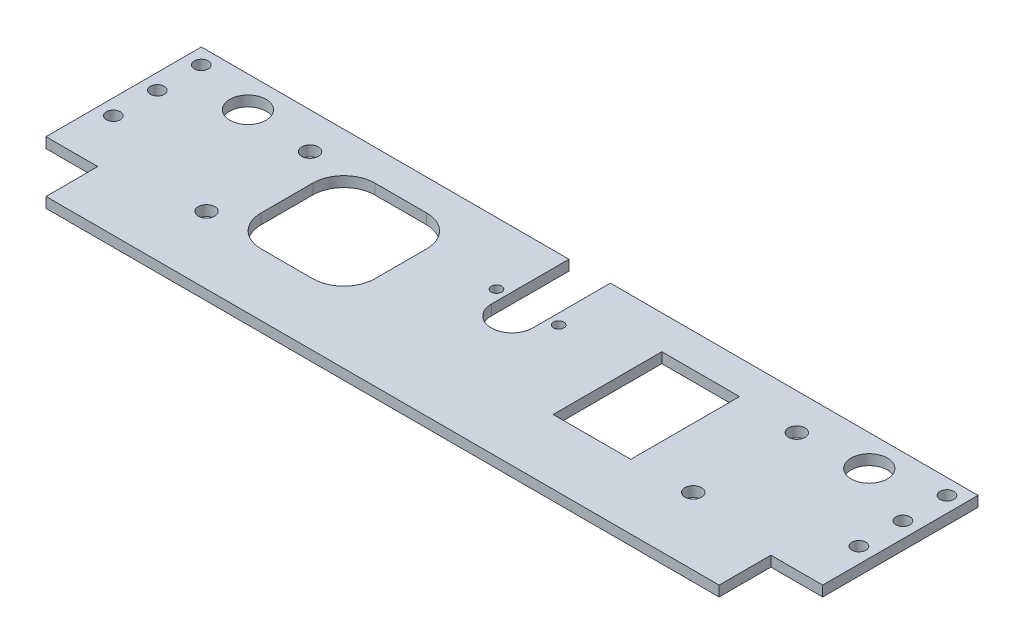
from build123d import *

# Parameters (mm, degrees)
SKETCH_1_R          = 1.35
SKETCH_1_R_2        = 3.5
SKETCH_1_R_3        = 1.6
SKETCH_1_R_4        = 1
SKETCH_1_W          = 22
SKETCH_1_H          = 22
SKETCH_1_W_2        = 15
SKETCH_1_H_2        = 21
EXTRUDE_1_DEPTH     = 2
FILLET_1_R          = 6
SKETCH_2_W          = 16.043978469
SKETCH_2_H          = 25.917195988
CUT_EXTRUDE_1_DEPTH = 79.472925267


with BuildPart() as part:
    # 草图1 → 凸台-拉伸1 (new body)
    with BuildSketch(Plane(origin=(0, 0, 0), x_dir=(1, 0, 0), z_dir=(0, 1, 0))):
        with BuildLine():
            Line((-75, 17), (-4, 17))
            Line((-4, 17), (-4, 2))
            ThreePointArc((-4, 2), (0, -2), (4, 2))
            Line((4, 2), (4, 17))
            Line((4, 17), (75, 17))
            Line((75, 17), (75, -17))
            Line((75, -17), (75, -23))
            Line((75, -23), (-75, -23))
            Line((-75, -23), (-75, -17))
            Line((-75, -17), (-75, 17))
        make_face()
        with Locations(Location((-72, 14, 0), (0, 0, 270))):
            Circle(SKETCH_1_R, mode=Mode.SUBTRACT)
        with Locations(Location((-72, -3, 0), (0, 0, 270))):
            Circle(SKETCH_1_R, mode=Mode.SUBTRACT)
        with Locations(Location((72, -3, 0), (0, 0, 90))):
            Circle(SKETCH_1_R, mode=Mode.SUBTRACT)
        with Locations(Location((72, 14, 0), (0, 0, 90))):
            Circle(SKETCH_1_R, mode=Mode.SUBTRACT)
        with Locations(Location((-60, 11, 0), (0, 0, 270))):
            Circle(SKETCH_1_R_2, mode=Mode.SUBTRACT)
        with Locations(Location((60, 11, 0), (0, 0, 90))):
            Circle(SKETCH_1_R_2, mode=Mode.SUBTRACT)
        with Locations(Location((-47, 10, 0), (0, 0, 270))):
            Circle(SKETCH_1_R_3, mode=Mode.SUBTRACT)
        with Locations(Location((47, 10, 0), (0, 0, 90))):
            Circle(SKETCH_1_R_3, mode=Mode.SUBTRACT)
        with Locations(Location((47, -10, 0), (0, 0, 270))):
            Circle(SKETCH_1_R_3, mode=Mode.SUBTRACT)
        with Locations(Location((-47, -10, 0), (0, 0, 90))):
            Circle(SKETCH_1_R_3, mode=Mode.SUBTRACT)
        with Locations(Location((-6, 5, 0), (0, 0, 270))):
            Circle(SKETCH_1_R_4, mode=Mode.SUBTRACT)
        with Locations(Location((6, 5, 0), (0, 0, 90))):
            Circle(SKETCH_1_R_4, mode=Mode.SUBTRACT)
        with Locations(Location((-72, 5.5, 0), (0, 0, 270))):
            Circle(SKETCH_1_R, mode=Mode.SUBTRACT)
        with Locations(Location((72, 5.5, 0), (0, 0, 90))):
            Circle(SKETCH_1_R, mode=Mode.SUBTRACT)
        with Locations((-30.48, 0)):
            Rectangle(SKETCH_1_W, SKETCH_1_H, mode=Mode.SUBTRACT)
        with Locations((27.94, 0)):
            Rectangle(SKETCH_1_W_2, SKETCH_1_H_2, mode=Mode.SUBTRACT)
    extrude(amount=EXTRUDE_1_DEPTH)

    # 圆角1
    fillet_1_edges = [part.edges().sort_by_distance(p)[0] for p in [
        (-19.48, 1, 11),
        (-19.48, 1, -11),
        (-41.48, 1, -11),
        (-41.48, 1, 11),
    ]]
    fillet(fillet_1_edges, radius=FILLET_1_R)

    # 草图2 → 切除-拉伸1 (cut, through all)
    with BuildSketch(Plane.XZ):
        with Locations((-73.021989235, 25.958597994)):
            Rectangle(SKETCH_2_W, SKETCH_2_H)
        with Locations((73.021989235, 25.958597994)):
            Rectangle(SKETCH_2_W, SKETCH_2_H)
    extrude(amount=-CUT_EXTRUDE_1_DEPTH, mode=Mode.SUBTRACT)


solid = part.part
